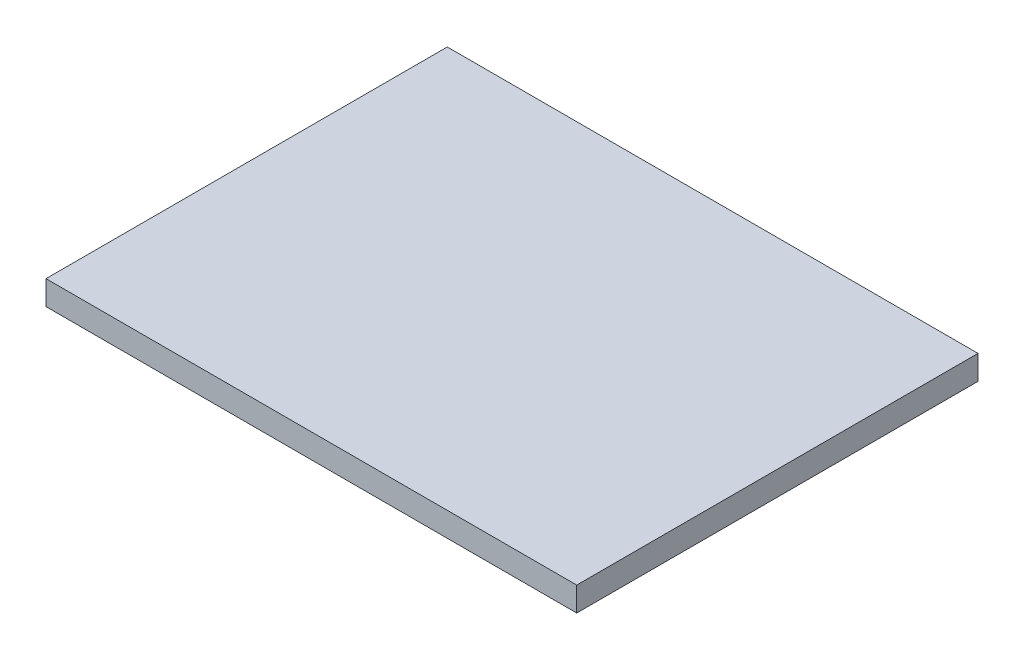
from build123d import *

# Parameters (mm, degrees)
SKETCH1_W           = 260.35
SKETCH1_H           = 196.85
BOSS_EXTRUDE1_DEPTH = 11.8872


with BuildPart() as part:
    # Sketch1 → Boss-Extrude1 (new body)
    with BuildSketch(Plane(origin=(0, 0, 0), x_dir=(1, 0, 0), z_dir=(0, 1, 0))):
        with Locations((130.175, 98.425)):
            Rectangle(SKETCH1_W, SKETCH1_H)
    extrude(amount=BOSS_EXTRUDE1_DEPTH)


solid = part.part
